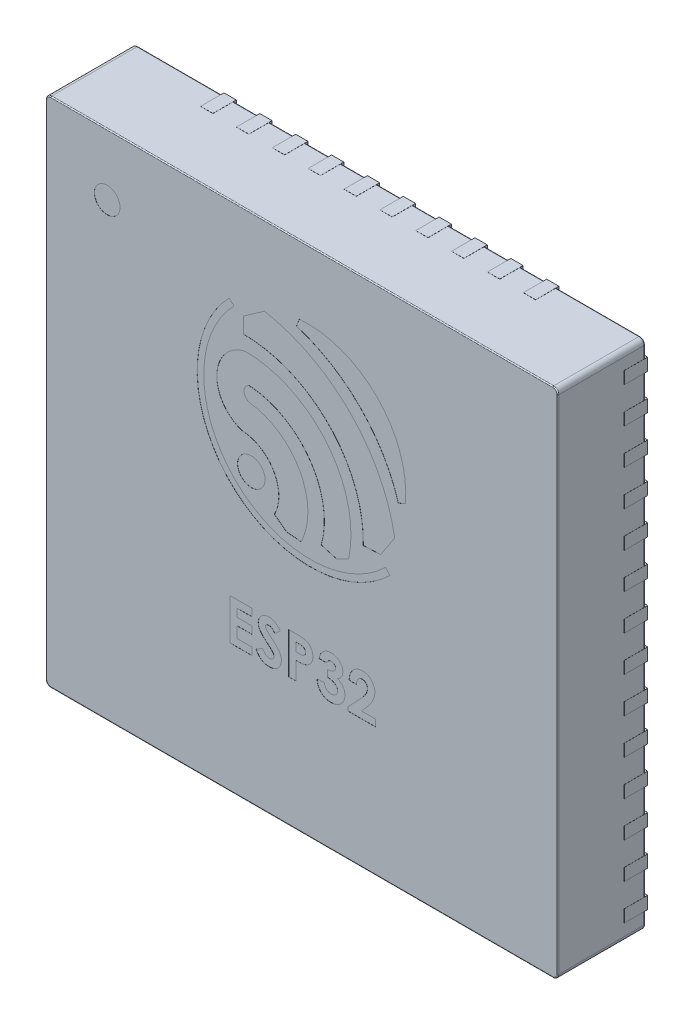
from build123d import *

# Parameters (mm, degrees)
SKETCH1_W                = 5
SKETCH1_H                = 5
BOSS_EXTRUDE1_DEPTH      = 0.85
FILLET1_R                = 0.05
FILLET2_R                = 0.01
BOSS_EXTRUDE2_DEPTH      = 0.025
BOSS_EXTRUDE2_DEPTH_BACK = 0.203
SKETCH2_W                = 0.12
SKETCH2_H                = 0.35
SKETCH2_W_2              = 0.35
SKETCH2_H_2              = 0.12
SKETCH3_R                = 0.125
SKETCH3_R_2              = 0.134340001
CUT_EXTRUDE1_DEPTH       = 0.001
BODY_MOVE_COPY1_ANGLE    = 180


with BuildPart() as part:
    # Sketch1 → Boss-Extrude1 (new body)
    with BuildSketch(Plane(origin=(0, 0, 0), x_dir=(1, 0, 0), z_dir=(0, 1, 0))):
        Rectangle(SKETCH1_W, SKETCH1_H)
    extrude(amount=BOSS_EXTRUDE1_DEPTH)

    # Fillet1
    fillet1_edges = [part.edges().sort_by_distance(p)[0] for p in [
        (2.5, 0.425, 2.5),
        (-2.5, 0.425, 2.5),
        (-2.5, 0.425, -2.5),
        (2.5, 0.425, -2.5),
    ]]
    fillet(fillet1_edges, radius=FILLET1_R)

    # Fillet2
    fillet2_edges = [part.edges().sort_by_distance(p)[0] for p in [
        (0, 0, -2.5),
        (0, 0.85, -2.5),
        (2.5, 0, 0),
        (0, 0, 2.5),
        (-2.5, 0, 0),
        (-2.485355339, 0, -2.485355339),
        (-2.485355339, 0, 2.485355339),
        (2.485355339, 0, 2.485355339),
        (2.485355339, 0, -2.485355339),
        (2.5, 0.85, 0),
        (-2.5, 0.85, 0),
        (0, 0.85, 2.5),
        (-2.485355339, 0.85, -2.485355339),
        (-2.485355339, 0.85, 2.485355339),
        (2.485355339, 0.85, 2.485355339),
        (2.485355339, 0.85, -2.485355339),
    ]]
    fillet(fillet2_edges, radius=FILLET2_R)

    # Sketch2 → Boss-Extrude2 (add, two sides: drawn at the far end of the back side and taken through both)
    with BuildSketch(Plane.XZ.offset(-BOSS_EXTRUDE2_DEPTH_BACK)):
        with BuildLine():
            Line((1.5, 1.85), (1.85, 1.5))
            Line((1.85, 1.5), (1.85, -1.75))
            ThreePointArc((1.85, -1.75), (1.820710678, -1.820710678), (1.75, -1.85))
            Line((1.75, -1.85), (-1.75, -1.85))
            ThreePointArc((-1.75, -1.85), (-1.820710678, -1.820710678), (-1.85, -1.75))
            Line((-1.85, -1.75), (-1.85, 1.75))
            ThreePointArc((-1.85, 1.75), (-1.820710678, 1.820710678), (-1.75, 1.85))
            Line((-1.75, 1.85), (1.5, 1.85))
        make_face()
        with Locations((-0.175, 2.326)):
            Rectangle(SKETCH2_W, SKETCH2_H)
        with Locations((-0.525, 2.326)):
            Rectangle(SKETCH2_W, SKETCH2_H)
        with Locations((-0.875, 2.326)):
            Rectangle(SKETCH2_W, SKETCH2_H)
        with Locations((-1.225, 2.326)):
            Rectangle(SKETCH2_W, SKETCH2_H)
        with Locations((-1.575, 2.326)):
            Rectangle(SKETCH2_W, SKETCH2_H)
        with Locations((1.575, 2.326)):
            Rectangle(SKETCH2_W, SKETCH2_H)
        with Locations((1.225, 2.326)):
            Rectangle(SKETCH2_W, SKETCH2_H)
        with Locations((0.875, 2.326)):
            Rectangle(SKETCH2_W, SKETCH2_H)
        with Locations((0.525, 2.326)):
            Rectangle(SKETCH2_W, SKETCH2_H)
        with Locations((0.175, 2.326)):
            Rectangle(SKETCH2_W, SKETCH2_H)
        with Locations((0.175, -2.326)):
            Rectangle(SKETCH2_W, SKETCH2_H)
        with Locations((0.525, -2.326)):
            Rectangle(SKETCH2_W, SKETCH2_H)
        with Locations((0.875, -2.326)):
            Rectangle(SKETCH2_W, SKETCH2_H)
        with Locations((1.225, -2.326)):
            Rectangle(SKETCH2_W, SKETCH2_H)
        with Locations((1.575, -2.326)):
            Rectangle(SKETCH2_W, SKETCH2_H)
        with Locations((-1.575, -2.326)):
            Rectangle(SKETCH2_W, SKETCH2_H)
        with Locations((-1.225, -2.326)):
            Rectangle(SKETCH2_W, SKETCH2_H)
        with Locations((-0.875, -2.326)):
            Rectangle(SKETCH2_W, SKETCH2_H)
        with Locations((-0.525, -2.326)):
            Rectangle(SKETCH2_W, SKETCH2_H)
        with Locations((-0.175, -2.326)):
            Rectangle(SKETCH2_W, SKETCH2_H)
        with Locations((-2.326, 0.175)):
            Rectangle(SKETCH2_W_2, SKETCH2_H_2)
        with Locations((-2.326, 0.525)):
            Rectangle(SKETCH2_W_2, SKETCH2_H_2)
        with Locations((-2.326, 0.875)):
            Rectangle(SKETCH2_W_2, SKETCH2_H_2)
        with Locations((-2.326, 1.225)):
            Rectangle(SKETCH2_W_2, SKETCH2_H_2)
        with Locations((-2.326, 1.575)):
            Rectangle(SKETCH2_W_2, SKETCH2_H_2)
        with Locations((-2.326, 1.925)):
            Rectangle(SKETCH2_W_2, SKETCH2_H_2)
        with Locations((-2.326, 2.275)):
            Rectangle(SKETCH2_W_2, SKETCH2_H_2)
        with Locations((-2.326, -2.275)):
            Rectangle(SKETCH2_W_2, SKETCH2_H_2)
        with Locations((-2.326, -1.925)):
            Rectangle(SKETCH2_W_2, SKETCH2_H_2)
        with Locations((-2.326, -1.575)):
            Rectangle(SKETCH2_W_2, SKETCH2_H_2)
        with Locations((-2.326, -1.225)):
            Rectangle(SKETCH2_W_2, SKETCH2_H_2)
        with Locations((-2.326, -0.875)):
            Rectangle(SKETCH2_W_2, SKETCH2_H_2)
        with Locations((-2.326, -0.525)):
            Rectangle(SKETCH2_W_2, SKETCH2_H_2)
        with Locations((-2.326, -0.175)):
            Rectangle(SKETCH2_W_2, SKETCH2_H_2)
        with Locations((2.326, -0.175)):
            Rectangle(SKETCH2_W_2, SKETCH2_H_2)
        with Locations((2.326, -0.525)):
            Rectangle(SKETCH2_W_2, SKETCH2_H_2)
        with Locations((2.326, -0.875)):
            Rectangle(SKETCH2_W_2, SKETCH2_H_2)
        with Locations((2.326, -1.225)):
            Rectangle(SKETCH2_W_2, SKETCH2_H_2)
        with Locations((2.326, -1.575)):
            Rectangle(SKETCH2_W_2, SKETCH2_H_2)
        with Locations((2.326, -1.925)):
            Rectangle(SKETCH2_W_2, SKETCH2_H_2)
        with Locations((2.326, -2.275)):
            Rectangle(SKETCH2_W_2, SKETCH2_H_2)
        with Locations((2.326, 2.275)):
            Rectangle(SKETCH2_W_2, SKETCH2_H_2)
        with Locations((2.326, 1.925)):
            Rectangle(SKETCH2_W_2, SKETCH2_H_2)
        with Locations((2.326, 1.575)):
            Rectangle(SKETCH2_W_2, SKETCH2_H_2)
        with Locations((2.326, 1.225)):
            Rectangle(SKETCH2_W_2, SKETCH2_H_2)
        with Locations((2.326, 0.875)):
            Rectangle(SKETCH2_W_2, SKETCH2_H_2)
        with Locations((2.326, 0.525)):
            Rectangle(SKETCH2_W_2, SKETCH2_H_2)
        with Locations((2.326, 0.175)):
            Rectangle(SKETCH2_W_2, SKETCH2_H_2)
    extrude(amount=BOSS_EXTRUDE2_DEPTH + BOSS_EXTRUDE2_DEPTH_BACK)

    # Sketch3 → Cut-Extrude1 (cut)
    # profile 1 of 11: a face of its own
    with BuildSketch(Plane(origin=(0, 0.85, 0), x_dir=(1, 0, 0), z_dir=(0, 1, 0))):
        with Locations(Location((1.9, -1.9, 0), (0, 0, 270))):
            Circle(SKETCH3_R)
    # profile 2 of 11: a face of its own
    with BuildSketch(Plane(origin=(0, 0.85, 0), x_dir=(1, 0, 0), z_dir=(0, 1, 0))):
        with Locations(Location((0.49329124, -0.30672013, 0), (0, 0, 270))):
            Circle(SKETCH3_R_2)
    # profile 3 of 11: a face of its own
    with BuildSketch(Plane(origin=(0, 0.85, 0), x_dir=(1, 0, 0), z_dir=(0, 1, 0))):
        with BuildLine():
            Line((-0.94208876, -0.758808576), (-1.01111876, -0.788208576))
            ThreePointArc((-1.01111876, -0.788208576), (-0.735182235, -1.550293391), (0.02546991, -1.830155047))
            Line((0.02546991, -1.830155047), (0.05178124, -1.756818576))
            ThreePointArc((0.05178124, -1.756818576), (-0.569576166, -1.381719845), (-0.94208876, -0.758808576))
        make_face()
    # profile 4 of 11: a face of its own
    with BuildSketch(Plane(origin=(0, 0.85, 0), x_dir=(1, 0, 0), z_dir=(0, 1, 0))):
        with BuildLine():
            Line((-0.599188761, -0.228917771), (-0.769318761, -0.236207771))
            Line((-0.769318761, -0.236207771), (-0.906808761, -0.446117771))
            ThreePointArc((-0.906808761, -0.446117771), (-0.472732698, -1.287214339), (0.365063195, -1.727627219))
            Line((0.365063195, -1.727627219), (0.571463195, -1.582817219))
            Line((0.571463195, -1.582817219), (0.571463195, -1.430687219))
            ThreePointArc((0.571463195, -1.430687219), (-0.267736701, -1.07710284), (-0.599188761, -0.228917771))
        make_face()
    # profile 5 of 11: a face of its own
    with BuildSketch(Plane(origin=(0, 0.85, 0), x_dir=(1, 0, 0), z_dir=(0, 1, 0))):
        with BuildLine():
            Line((0.66189124, -1.623318576), (0.70998124, -1.665858576))
            ThreePointArc((0.70998124, -1.665858576), (0.695008807, -0.110941509), (-0.859971661, -0.10574522))
            Line((-0.859971661, -0.10574522), (-0.817204672, -0.153640296))
            ThreePointArc((-0.817204672, -0.153640296), (0.649763481, -0.156397963), (0.66189124, -1.623318576))
        make_face()
    # profile 6 of 11: a face of its own
    with BuildSketch(Plane(origin=(0, 0.85, 0), x_dir=(1, 0, 0), z_dir=(0, 1, 0))):
        with BuildLine():
            Line((0.267423643, -0.058844391), (0.149043643, 0.030735609))
            Line((0.149043643, 0.030735609), (0.006903643, 0.043245609))
            ThreePointArc((0.006903643, 0.043245609), (0.019859029, -0.551251626), (0.513813949, -0.88231558))
            ThreePointArc((0.513813949, -0.88231558), (0.564101838, -0.953814834), (0.511159964, -1.02337181))
            ThreePointArc((0.511159964, -1.02337181), (-0.077147368, -0.694109806), (-0.189295274, -0.02932275))
            Line((-0.189295274, -0.02932275), (-0.339535274, 0.01540725))
            Line((-0.339535274, 0.01540725), (-0.456583251, -0.04317667))
            ThreePointArc((-0.456583251, -0.04317667), (-0.250094648, -0.910432452), (0.554224726, -1.29493275))
            ThreePointArc((0.554224726, -1.29493275), (0.83019729, -0.962662211), (0.583713532, -0.607964701))
            ThreePointArc((0.583713532, -0.607964701), (0.274602011, -0.420360357), (0.267423643, -0.058844391))
        make_face()
    # profile 7 of 11: a face of its own
    with BuildSketch(Plane(origin=(0, 0.85, 0), x_dir=(1, 0, 0), z_dir=(0, 1, 0))):
        with BuildLine():
            Line((-0.533333333, 0.978333333), (-0.461538462, 0.978333333))
            add(Edge.make_bspline(
                [(-0.461538462, 0.978333333), (-0.461848411, 0.972902374), (-0.462454033, 0.962290606), (-0.464865688, 0.946877627), (-0.468088919, 0.932310492), (-0.472427468, 0.918632998), (-0.477771364, 0.905839397), (-0.484253611, 0.893972067), (-0.491680672, 0.882945974), (-0.500202254, 0.872954494), (-0.509472506, 0.863971849), (-0.519467662, 0.856118985), (-0.530159331, 0.849545111), (-0.54147602, 0.844152532), (-0.553373277, 0.839837774), (-0.565971309, 0.836954528), (-0.579158952, 0.835001543), (-0.588187043, 0.834830677), (-0.592788462, 0.83474359)],
                knots=[0, 0, 0, 0, 1.198928049, 2.342633425, 3.435730849, 4.486331048, 5.502589352, 6.488331875, 7.46361919, 8.428949135, 9.378681775, 10.305958057, 11.226249248, 12.140413166, 13.066341608, 14.010670971, 14.986082777, 16, 16, 16, 16], degree=3))
            add(Edge.make_bspline(
                [(-0.592788462, 0.83474359), (-0.59843905, 0.834908269), (-0.609475169, 0.835229903), (-0.625460315, 0.838326648), (-0.640484419, 0.843096849), (-0.654399015, 0.84995776), (-0.667131174, 0.858648889), (-0.678529538, 0.869122818), (-0.688646419, 0.881251069), (-0.6971483, 0.894944996), (-0.704063409, 0.909496014), (-0.709056275, 0.924454365), (-0.712299223, 0.939518448), (-0.712647496, 0.949658233), (-0.712820513, 0.954695513)],
                knots=[0, 0, 0, 0, 1.075206757, 2.099977874, 3.089436832, 4.070080219, 5.043757236, 6.01602434, 7.009399377, 8.042659726, 9.078134622, 10.07077983, 11.041594984, 12, 12, 12, 12], degree=3))
            add(Edge.make_bspline(
                [(-0.712820513, 0.954695513), (-0.712753404, 0.957742592), (-0.712618332, 0.963875609), (-0.711679155, 0.97315637), (-0.710270203, 0.98260991), (-0.708145847, 0.992228123), (-0.705496604, 1.002013708), (-0.702282679, 1.01199594), (-0.69842957, 1.022118258), (-0.694001388, 1.032494456), (-0.688719194, 1.043158745), (-0.682566188, 1.054268824), (-0.675372589, 1.065855264), (-0.667208629, 1.077881992), (-0.658131816, 1.090442279), (-0.648003991, 1.103387367), (-0.636954867, 1.116863405), (-0.62911041, 1.125869628), (-0.625080128, 1.130496795)],
                knots=[0, 0, 0, 0, 0.728286467, 1.465860763, 2.227952348, 3.011875114, 3.818782069, 4.650637576, 5.517456182, 6.406927181, 7.346324104, 8.360844784, 9.441645378, 10.605053135, 11.834886952, 13.145197974, 14.533275831, 16, 16, 16, 16], degree=3))
            Line((-0.625080128, 1.130496795), (-0.583333333, 1.178333333))
            Line((-0.583333333, 1.178333333), (-0.717948718, 1.178333333))
            Line((-0.717948718, 1.178333333), (-0.717948718, 1.245))
            Line((-0.717948718, 1.245), (-0.451282051, 1.245))
            Line((-0.451282051, 1.245), (-0.451282051, 1.208621795))
            Line((-0.451282051, 1.208621795), (-0.569711538, 1.082580128))
            add(Edge.make_bspline(
                [(-0.569711538, 1.082580128), (-0.573140431, 1.07890349), (-0.579781178, 1.071782933), (-0.589229396, 1.061325039), (-0.597782345, 1.05140289), (-0.605248782, 1.041901421), (-0.612080449, 1.03314234), (-0.61779564, 1.024794519), (-0.622772872, 1.017093049), (-0.627972116, 1.007705263), (-0.63302332, 0.996593223), (-0.637655193, 0.983799609), (-0.640450338, 0.971563287), (-0.640839126, 0.963575561), (-0.641025641, 0.95974359)],
                knots=[0, 0, 0, 0, 1.246192343, 2.413505005, 3.49357156, 4.492416076, 5.408771964, 6.246246772, 6.999304986, 7.680960093, 8.904522682, 10.020616941, 11.0504258, 12, 12, 12, 12], degree=3))
            add(Edge.make_bspline(
                [(-0.641025641, 0.95974359), (-0.640888728, 0.956035218), (-0.640623438, 0.948849653), (-0.637635446, 0.938657963), (-0.633164672, 0.929360403), (-0.626673956, 0.921380503), (-0.618839827, 0.914765908), (-0.609735267, 0.909918813), (-0.599527444, 0.907069945), (-0.592379212, 0.906719), (-0.588701923, 0.906538462)],
                knots=[0, 0, 0, 0, 1.061596218, 2.057012874, 3.024113775, 4.006148568, 4.986025304, 5.949989669, 6.945406325, 8, 8, 8, 8], degree=3))
            add(Edge.make_bspline(
                [(-0.588701923, 0.906538462), (-0.586802563, 0.906605641), (-0.583063369, 0.906737894), (-0.577567045, 0.90761827), (-0.572336898, 0.90916984), (-0.567314714, 0.911248725), (-0.56255409, 0.914004302), (-0.558067034, 0.91740099), (-0.55380627, 0.921352471), (-0.549791339, 0.925846389), (-0.546137227, 0.930861604), (-0.542891658, 0.93635231), (-0.540208113, 0.942315101), (-0.537845423, 0.948671257), (-0.536023203, 0.955489049), (-0.534696401, 0.962727675), (-0.533687722, 0.970375356), (-0.533453612, 0.975632418), (-0.533333333, 0.978333333)],
                knots=[0, 0, 0, 0, 0.903469896, 1.778625579, 2.63899355, 3.493148037, 4.358286772, 5.247621495, 6.164656832, 7.118446693, 8.109501108, 9.111810964, 10.146451449, 11.215617525, 12.33435995, 13.498009769, 14.714554818, 16, 16, 16, 16], degree=3))
        make_face()
    # profile 8 of 11: a face of its own
    with BuildSketch(Plane(origin=(0, 0.85, 0), x_dir=(1, 0, 0), z_dir=(0, 1, 0))):
        with BuildLine():
            Line((-0.241025641, 0.942435897), (-0.169230769, 0.942435897))
            add(Edge.make_bspline(
                [(-0.169230769, 0.942435897), (-0.169734506, 0.938846343), (-0.170718429, 0.931835054), (-0.173137182, 0.921660172), (-0.175934323, 0.91198461), (-0.179511471, 0.902860293), (-0.183640643, 0.894297058), (-0.188455818, 0.886287242), (-0.193733569, 0.878715897), (-0.197865718, 0.874178624), (-0.199919872, 0.871923077)],
                knots=[0, 0, 0, 0, 1.1115466, 2.171125598, 3.205689823, 4.19946166, 5.17440286, 6.118867946, 7.064860634, 8, 8, 8, 8], degree=3))
            add(Edge.make_bspline(
                [(-0.199919872, 0.871923077), (-0.20287541, 0.868942445), (-0.208700464, 0.863067932), (-0.218434814, 0.85554333), (-0.22863821, 0.849031298), (-0.239515286, 0.843868513), (-0.250896787, 0.839689836), (-0.262873221, 0.836883009), (-0.27539565, 0.835020655), (-0.283940633, 0.834837207), (-0.288301282, 0.83474359)],
                knots=[0, 0, 0, 0, 1.01925491, 2.00884431, 2.983262333, 3.955970413, 4.92937149, 5.924503185, 6.940838805, 8, 8, 8, 8], degree=3))
            add(Edge.make_bspline(
                [(-0.288301282, 0.83474359), (-0.292178124, 0.834835114), (-0.299799213, 0.835015033), (-0.311000297, 0.836459325), (-0.321679593, 0.838992453), (-0.331949985, 0.84230446), (-0.341660428, 0.846810999), (-0.351025241, 0.852042132), (-0.359782772, 0.858458334), (-0.367953511, 0.865707996), (-0.375459892, 0.873549216), (-0.381960452, 0.881930835), (-0.3875491, 0.89062896), (-0.392153406, 0.899715858), (-0.395693492, 0.909206904), (-0.398150417, 0.919047269), (-0.399758534, 0.929215241), (-0.399918744, 0.936126274), (-0.4, 0.93963141)],
                knots=[0, 0, 0, 0, 1.091422571, 2.145516843, 3.172569842, 4.178562979, 5.178154469, 6.181868002, 7.194278174, 8.227918432, 9.254613415, 10.245994977, 11.209837596, 12.161663635, 13.10878368, 14.055455738, 15.013766427, 16, 16, 16, 16], degree=3))
            add(Edge.make_bspline(
                [(-0.4, 0.93963141), (-0.399830048, 0.943971459), (-0.399494441, 0.952541855), (-0.396840278, 0.965060586), (-0.39257356, 0.97700354), (-0.386506919, 0.988229211), (-0.378888544, 0.998725904), (-0.369546051, 1.008127017), (-0.358740151, 1.016578144), (-0.350628243, 1.021119837), (-0.346474359, 1.023445513)],
                knots=[0, 0, 0, 0, 0.992776698, 1.96045919, 2.915875678, 3.886951799, 4.871409521, 5.874469288, 6.911574252, 8, 8, 8, 8], degree=3))
            add(Edge.make_bspline(
                [(-0.346474359, 1.023445513), (-0.349325628, 1.02438149), (-0.354928244, 1.026220644), (-0.362890083, 1.029845073), (-0.370467114, 1.033797557), (-0.377486053, 1.03841166), (-0.384139377, 1.043367566), (-0.390216583, 1.048931741), (-0.395875041, 1.054961359), (-0.400974765, 1.061520567), (-0.405534155, 1.068500307), (-0.409552301, 1.075775128), (-0.412924281, 1.08337162), (-0.415754366, 1.091233959), (-0.417913643, 1.099439522), (-0.419432773, 1.107960503), (-0.420311153, 1.11677637), (-0.420445094, 1.122749155), (-0.420512821, 1.125769231)],
                knots=[0, 0, 0, 0, 1.059375415, 2.081625174, 3.086260357, 4.075579879, 5.045586876, 6.014170127, 6.982201689, 7.963705737, 8.945119069, 9.924852636, 10.896327119, 11.878239286, 12.873838556, 13.889973282, 14.933087432, 16, 16, 16, 16], degree=3))
            add(Edge.make_bspline(
                [(-0.420512821, 1.125769231), (-0.42038728, 1.130209463), (-0.420139633, 1.138968417), (-0.418249278, 1.151827447), (-0.415213051, 1.164153387), (-0.410947233, 1.175961772), (-0.405361939, 1.187217141), (-0.398616047, 1.197995179), (-0.390627141, 1.208211196), (-0.381516347, 1.217774681), (-0.371483209, 1.226551231), (-0.360675049, 1.234297881), (-0.349085081, 1.240685662), (-0.336989763, 1.24614502), (-0.32411762, 1.250196849), (-0.310634891, 1.253164024), (-0.296443196, 1.254969352), (-0.286757468, 1.255159368), (-0.281810897, 1.25525641)],
                knots=[0, 0, 0, 0, 1.005301618, 1.9830924, 2.936709333, 3.876255674, 4.820386332, 5.77704884, 6.75110905, 7.752325838, 8.764085485, 9.766124222, 10.757295257, 11.756573224, 12.766631673, 13.80722022, 14.880131728, 16, 16, 16, 16], degree=3))
            add(Edge.make_bspline(
                [(-0.281810897, 1.25525641), (-0.277131407, 1.255154355), (-0.267981283, 1.254954801), (-0.254597569, 1.253226741), (-0.241876637, 1.250441166), (-0.229790584, 1.246507988), (-0.218390867, 1.241440517), (-0.20761107, 1.235323995), (-0.197568875, 1.227971012), (-0.188218049, 1.219555051), (-0.179637868, 1.210242893), (-0.172159904, 1.199958636), (-0.165652104, 1.188926998), (-0.160071518, 1.177124255), (-0.155711286, 1.164445096), (-0.152243709, 1.151002751), (-0.149829581, 1.136739093), (-0.149093331, 1.126926236), (-0.148717949, 1.121923077)],
                knots=[0, 0, 0, 0, 1.066693477, 2.085777942, 3.071407889, 4.032495163, 4.978645371, 5.911608997, 6.853298848, 7.810770565, 8.776420673, 9.735131334, 10.704462168, 11.693492242, 12.70668109, 13.756973703, 14.856375978, 16, 16, 16, 16], degree=3))
            Line((-0.148717949, 1.121923077), (-0.220512821, 1.121923077))
            add(Edge.make_bspline(
                [(-0.220512821, 1.121923077), (-0.220967866, 1.124438726), (-0.221854186, 1.129338611), (-0.223581336, 1.136433254), (-0.225837973, 1.142979471), (-0.228417978, 1.149025354), (-0.231270477, 1.154632952), (-0.234678719, 1.159652307), (-0.23833311, 1.164280679), (-0.243826493, 1.169600682), (-0.25149102, 1.175179829), (-0.26186834, 1.180120978), (-0.273464786, 1.182931195), (-0.28155541, 1.183280826), (-0.285737179, 1.183461538)],
                knots=[0, 0, 0, 0, 0.928450228, 1.808400301, 2.64896863, 3.43999153, 4.194978884, 4.9294959, 5.640047715, 6.332896648, 7.70085756, 9.063442004, 10.482192841, 12, 12, 12, 12], degree=3))
            add(Edge.make_bspline(
                [(-0.285737179, 1.183461538), (-0.287956515, 1.183423349), (-0.292303698, 1.183348543), (-0.29869011, 1.182524115), (-0.304770056, 1.181156492), (-0.310607047, 1.17932077), (-0.316121466, 1.176900033), (-0.321383813, 1.174021296), (-0.32630045, 1.170521673), (-0.330886866, 1.166575346), (-0.335037612, 1.162229748), (-0.338791733, 1.157690483), (-0.341804782, 1.152772074), (-0.344305859, 1.147669029), (-0.346368947, 1.142382668), (-0.347663324, 1.136792708), (-0.348632401, 1.131011193), (-0.348689148, 1.127055615), (-0.348717949, 1.125048077)],
                knots=[0, 0, 0, 0, 1.110416125, 2.175056767, 3.216269732, 4.226816172, 5.232753079, 6.226173397, 7.223992381, 8.247806573, 9.250094092, 10.229378924, 11.190237183, 12.128982156, 13.072570213, 14.022671385, 14.996464856, 16, 16, 16, 16], degree=3))
            add(Edge.make_bspline(
                [(-0.348717949, 1.125048077), (-0.348644822, 1.122851746), (-0.348500119, 1.118505625), (-0.347226736, 1.112136593), (-0.34532067, 1.105986373), (-0.342579393, 1.100105709), (-0.33899231, 1.094529185), (-0.334630785, 1.089210618), (-0.329455363, 1.084192351), (-0.323639354, 1.079328232), (-0.316948093, 1.075070205), (-0.309651783, 1.071149199), (-0.301570674, 1.068027112), (-0.292898633, 1.065239191), (-0.283472604, 1.063202767), (-0.273350837, 1.061724174), (-0.26254974, 1.060623576), (-0.255104401, 1.060465678), (-0.251282051, 1.060384615)],
                knots=[0, 0, 0, 0, 0.809868251, 1.602574917, 2.388262527, 3.182133002, 3.988875265, 4.829537611, 5.714850619, 6.646378958, 7.622533229, 8.636771727, 9.698525113, 10.814716514, 11.996253919, 13.252421425, 14.589425562, 16, 16, 16, 16], degree=3))
            Line((-0.251282051, 1.060384615), (-0.251282051, 0.993717949))
            add(Edge.make_bspline(
                [(-0.251282051, 0.993717949), (-0.256041581, 0.993313795), (-0.264945718, 0.992557704), (-0.277298146, 0.990770797), (-0.287752578, 0.988434494), (-0.296421396, 0.98544169), (-0.303727264, 0.981929466), (-0.309947033, 0.977762541), (-0.315484176, 0.973148648), (-0.320004857, 0.967849105), (-0.323657985, 0.962254859), (-0.326244668, 0.956381315), (-0.327961738, 0.950359048), (-0.328124486, 0.946239806), (-0.328205128, 0.944198718)],
                knots=[0, 0, 0, 0, 1.700278244, 3.18088388, 4.44026007, 5.507838349, 6.439172496, 7.317391478, 8.167251366, 8.996486918, 9.787781501, 10.536992524, 11.275078289, 12, 12, 12, 12], degree=3))
            add(Edge.make_bspline(
                [(-0.328205128, 0.944198718), (-0.328069207, 0.941592848), (-0.327803917, 0.936506741), (-0.325647777, 0.92924541), (-0.322144656, 0.922665192), (-0.317212355, 0.916992941), (-0.311177572, 0.912309618), (-0.304147329, 0.908896094), (-0.29624082, 0.906854285), (-0.290690849, 0.90664612), (-0.287820513, 0.906538462)],
                knots=[0, 0, 0, 0, 1.008776249, 1.968917671, 2.909425455, 3.878736958, 4.86052431, 5.85160606, 6.888892716, 8, 8, 8, 8], degree=3))
            add(Edge.make_bspline(
                [(-0.287820513, 0.906538462), (-0.285219002, 0.90666622), (-0.280056809, 0.906919731), (-0.272511184, 0.908820291), (-0.265353608, 0.911987306), (-0.258767645, 0.916434693), (-0.25276949, 0.921720953), (-0.247740159, 0.927931041), (-0.243645973, 0.934822059), (-0.241902509, 0.939888002), (-0.241025641, 0.942435897)],
                knots=[0, 0, 0, 0, 0.988439209, 1.961366134, 2.938893463, 3.950078543, 4.971412263, 5.967491143, 6.977757845, 8, 8, 8, 8], degree=3))
        make_face()
    # profile 9 of 11: a face of its own
    with BuildSketch(Plane(origin=(0, 0.85, 0), x_dir=(1, 0, 0), z_dir=(0, 1, 0))):
        with BuildLine():
            Line((0.128205128, 0.845), (0.048076923, 0.845))
            add(Edge.make_bspline(
                [(0.048076923, 0.845), (0.04284145, 0.845023435), (0.032741125, 0.845068646), (0.018175626, 0.845616893), (0.004738239, 0.846599381), (-0.007567943, 0.84781359), (-0.018737884, 0.849515835), (-0.028785488, 0.85146741), (-0.037713114, 0.853844722), (-0.045620552, 0.856667434), (-0.052719411, 0.859992389), (-0.059429328, 0.86354381), (-0.065649314, 0.867753469), (-0.071525397, 0.872317926), (-0.077013127, 0.877332141), (-0.082153169, 0.882776297), (-0.086892595, 0.888729512), (-0.091201692, 0.895150775), (-0.095112855, 0.901909353), (-0.098529339, 0.909020659), (-0.101300746, 0.916495039), (-0.10362557, 0.924284388), (-0.105492903, 0.9323883), (-0.106735856, 0.940856632), (-0.107580133, 0.94963025), (-0.107654629, 0.95560158), (-0.107692308, 0.958621795)],
                knots=[0, 0, 0, 0, 1.698787518, 3.27731721, 4.728409951, 6.070286353, 7.288646904, 8.393455548, 9.389990496, 10.283725379, 11.113616976, 11.931887102, 12.744353494, 13.547053751, 14.344590688, 15.153907614, 15.974148981, 16.810666655, 17.660988447, 18.506082349, 19.367288142, 20.244738011, 21.142497992, 22.06302001, 23.020302899, 24, 24, 24, 24], degree=3))
            add(Edge.make_bspline(
                [(-0.107692308, 0.958621795), (-0.107638027, 0.961963083), (-0.10753136, 0.968529125), (-0.106477774, 0.978152487), (-0.104695691, 0.987333736), (-0.102309982, 0.996112095), (-0.099198157, 1.004468359), (-0.095297998, 1.012347634), (-0.090836751, 1.019848654), (-0.085570071, 1.026834224), (-0.079750372, 1.033339904), (-0.073483888, 1.039436491), (-0.066582588, 1.044873405), (-0.059292801, 1.049933305), (-0.051405947, 1.054319194), (-0.043155697, 1.058380345), (-0.034332803, 1.061826603), (-0.028192989, 1.063634623), (-0.025080128, 1.064551282)],
                knots=[0, 0, 0, 0, 1.101767505, 2.165108537, 3.187936629, 4.183892551, 5.162396277, 6.123736501, 7.080098904, 8.036826416, 9.0040019, 9.957275584, 10.916231297, 11.898534744, 12.880877694, 13.889532316, 14.930001539, 16, 16, 16, 16], degree=3))
            add(Edge.make_bspline(
                [(-0.025080128, 1.064551282), (-0.023029589, 1.06506146), (-0.01858746, 1.066166668), (-0.011236956, 1.067288733), (-0.002766273, 1.068320402), (0.006851981, 1.069206997), (0.017623352, 1.069809675), (0.02953741, 1.070280339), (0.042599554, 1.070622561), (0.051682453, 1.070634705), (0.056410256, 1.070641026)],
                knots=[0, 0, 0, 0, 0.618981996, 1.340914327, 2.176866532, 3.120127938, 4.170906482, 5.338178032, 6.614476169, 8, 8, 8, 8], degree=3))
            Line((0.056410256, 1.070641026), (0.056410256, 1.245))
            Line((0.056410256, 1.245), (0.128205128, 1.245))
            Line((0.128205128, 1.245), (0.128205128, 0.845))
        make_face()
        with BuildLine():
            Line((0.056410256, 0.998846154), (0.031009615, 0.998846154))
            add(Edge.make_bspline(
                [(0.031009615, 0.998846154), (0.026387492, 0.998816956), (0.017882717, 0.99876323), (0.006269246, 0.997982188), (-0.003066623, 0.996794697), (-0.010434034, 0.995077659), (-0.016253547, 0.992520984), (-0.021212375, 0.989437369), (-0.025617983, 0.985731846), (-0.029290404, 0.981289502), (-0.032283073, 0.97633326), (-0.034382095, 0.970825696), (-0.035706908, 0.964854826), (-0.03583273, 0.960685695), (-0.035897436, 0.958541667)],
                knots=[0, 0, 0, 0, 1.862351722, 3.426754836, 4.68713255, 5.653025869, 6.462861518, 7.236406327, 7.999926698, 8.771672214, 9.54880311, 10.322347919, 11.137246204, 12, 12, 12, 12], degree=3))
            add(Edge.make_bspline(
                [(-0.035897436, 0.958541667), (-0.035834748, 0.956667989), (-0.035713118, 0.953032603), (-0.034807278, 0.947789529), (-0.033401369, 0.942911489), (-0.031252709, 0.938466481), (-0.02864404, 0.93435083), (-0.025334619, 0.930692655), (-0.021518176, 0.927373604), (-0.018566764, 0.92561899), (-0.017067308, 0.924727564)],
                knots=[0, 0, 0, 0, 1.102449765, 2.139017612, 3.12397484, 4.080535277, 5.035673127, 5.982361139, 6.974944601, 8, 8, 8, 8], degree=3))
            add(Edge.make_bspline(
                [(-0.017067308, 0.924727564), (-0.015797503, 0.924085387), (-0.013109065, 0.922725767), (-0.008530396, 0.92114511), (-0.003246681, 0.919811651), (0.002777749, 0.918704893), (0.009518863, 0.917845934), (0.016975457, 0.917189046), (0.025158505, 0.916924885), (0.030849325, 0.916839405), (0.033814103, 0.916794872)],
                knots=[0, 0, 0, 0, 0.656809284, 1.390599849, 2.23162475, 3.173112763, 4.218524733, 5.370385145, 6.63003504, 8, 8, 8, 8], degree=3))
            Line((0.033814103, 0.916794872), (0.056410256, 0.916794872))
            Line((0.056410256, 0.916794872), (0.056410256, 0.998846154))
        make_face(mode=Mode.SUBTRACT)
    # profile 10 of 11: a face of its own
    with BuildSketch(Plane(origin=(0, 0.85, 0), x_dir=(1, 0, 0), z_dir=(0, 1, 0))):
        with BuildLine():
            Line((0.21025641, 0.898445513), (0.263942308, 0.947564103))
            add(Edge.make_bspline(
                [(0.263942308, 0.947564103), (0.266241539, 0.944319594), (0.270655742, 0.938090591), (0.277817897, 0.929758914), (0.284937263, 0.922604746), (0.292159403, 0.916832635), (0.299359975, 0.912185903), (0.306691957, 0.908980865), (0.314071002, 0.906919686), (0.319031185, 0.906664269), (0.321474359, 0.906538462)],
                knots=[0, 0, 0, 0, 1.299459705, 2.494781419, 3.587730629, 4.594196874, 5.512431013, 6.380462003, 7.202284646, 8, 8, 8, 8], degree=3))
            add(Edge.make_bspline(
                [(0.321474359, 0.906538462), (0.323754215, 0.906616), (0.328156019, 0.906765708), (0.334401888, 0.908328668), (0.340014857, 0.910854328), (0.34484541, 0.914343124), (0.348731486, 0.918509759), (0.351753141, 0.922945345), (0.353509031, 0.927781595), (0.353734522, 0.931098379), (0.353846154, 0.932740385)],
                knots=[0, 0, 0, 0, 1.184157716, 2.286297433, 3.324836695, 4.370048774, 5.362957217, 6.276446515, 7.146738784, 8, 8, 8, 8], degree=3))
            add(Edge.make_bspline(
                [(0.353846154, 0.932740385), (0.353775491, 0.934405297), (0.353633187, 0.937758201), (0.352258719, 0.942672298), (0.350187003, 0.947473943), (0.348207395, 0.950396932), (0.347195513, 0.951891026)],
                knots=[0, 0, 0, 0, 0.967525499, 1.948461899, 2.951351359, 4, 4, 4, 4], degree=3))
            add(Edge.make_bspline(
                [(0.347195513, 0.951891026), (0.346271893, 0.953048914), (0.344133558, 0.95572962), (0.340180106, 0.960043247), (0.335010729, 0.965107205), (0.328843917, 0.971176653), (0.32144824, 0.978015832), (0.312982486, 0.985822762), (0.303258304, 0.994332249), (0.296445521, 1.000339558), (0.29286859, 1.00349359)],
                knots=[0, 0, 0, 0, 0.473849886, 1.097042329, 1.870584189, 2.789244661, 3.865562256, 5.093556389, 6.47402294, 8, 8, 8, 8], degree=3))
            add(Edge.make_bspline(
                [(0.29286859, 1.00349359), (0.28950308, 1.00640478), (0.283116041, 1.011929614), (0.274040071, 1.019784124), (0.266011872, 1.02681892), (0.259104458, 1.03308668), (0.253111419, 1.03832929), (0.248297813, 1.042869282), (0.244457627, 1.046508052), (0.242276852, 1.048708389), (0.241346154, 1.049647436)],
                knots=[0, 0, 0, 0, 1.543627419, 2.929484142, 4.163674036, 5.24627963, 6.164986907, 6.925413438, 7.541394495, 8, 8, 8, 8], degree=3))
            add(Edge.make_bspline(
                [(0.241346154, 1.049647436), (0.237813102, 1.053467953), (0.231021337, 1.060812328), (0.222211739, 1.072224611), (0.214883005, 1.0832792), (0.20920765, 1.094288257), (0.205091633, 1.105479296), (0.202095318, 1.117011985), (0.200299316, 1.129051219), (0.200100539, 1.137248245), (0.2, 1.141394231)],
                knots=[0, 0, 0, 0, 1.206413378, 2.319150186, 3.339784753, 4.27899982, 5.184598145, 6.099639703, 7.038813909, 8, 8, 8, 8], degree=3))
            add(Edge.make_bspline(
                [(0.2, 1.141394231), (0.200071649, 1.145434019), (0.200212228, 1.153360233), (0.201932184, 1.164959606), (0.204388247, 1.176058649), (0.208172749, 1.186546175), (0.212824201, 1.196546467), (0.218493199, 1.20606289), (0.225424115, 1.214873272), (0.233122343, 1.223215342), (0.24177049, 1.23070322), (0.251070033, 1.23730475), (0.261038681, 1.242878587), (0.271600467, 1.247472004), (0.282887852, 1.250880826), (0.294722523, 1.253458094), (0.307223718, 1.255012065), (0.315754126, 1.255173788), (0.320112179, 1.25525641)],
                knots=[0, 0, 0, 0, 1.043039441, 2.046482205, 3.024244422, 3.976033659, 4.920890471, 5.871402525, 6.830893638, 7.812473116, 8.800703348, 9.781190227, 10.754606487, 11.746997808, 12.751247331, 13.796362838, 14.874195872, 16, 16, 16, 16], degree=3))
            add(Edge.make_bspline(
                [(0.320112179, 1.25525641), (0.323533265, 1.255195784), (0.330308975, 1.25507571), (0.340294877, 1.254093387), (0.3499392, 1.25251302), (0.359222683, 1.250230432), (0.36820405, 1.247404204), (0.376785832, 1.243729096), (0.38508213, 1.239573036), (0.393065354, 1.234756835), (0.400669351, 1.229163285), (0.408113206, 1.22301316), (0.415133027, 1.215969152), (0.421997022, 1.208288052), (0.428418517, 1.199747245), (0.434735891, 1.190603731), (0.44064081, 1.180638928), (0.444289948, 1.173649945), (0.446153846, 1.170080128)],
                knots=[0, 0, 0, 0, 1.017088714, 2.014418954, 2.980620591, 3.920647918, 4.854987948, 5.776890852, 6.693269322, 7.612671471, 8.545186947, 9.498010697, 10.480815007, 11.499174288, 12.558697099, 13.655746277, 14.802607237, 16, 16, 16, 16], degree=3))
            Line((0.446153846, 1.170080128), (0.383012821, 1.132179487))
            add(Edge.make_bspline(
                [(0.383012821, 1.132179487), (0.380681528, 1.136231832), (0.376212241, 1.144000522), (0.368638616, 1.154438743), (0.360879823, 1.163377351), (0.352756488, 1.170658356), (0.344367385, 1.176379114), (0.335671995, 1.180467565), (0.326664207, 1.182998312), (0.320528511, 1.183307374), (0.317467949, 1.183461538)],
                knots=[0, 0, 0, 0, 1.283663364, 2.460892379, 3.537111102, 4.529833553, 5.449777664, 6.316464042, 7.160231139, 8, 8, 8, 8], degree=3))
            add(Edge.make_bspline(
                [(0.317467949, 1.183461538), (0.314354346, 1.183336836), (0.308313502, 1.183094895), (0.299676776, 1.180816054), (0.291723595, 1.177318334), (0.284885879, 1.172231439), (0.279079344, 1.166430899), (0.274916655, 1.159888802), (0.272216464, 1.152895383), (0.271935953, 1.1480153), (0.271794872, 1.145560897)],
                knots=[0, 0, 0, 0, 1.13537643, 2.202795631, 3.242191317, 4.290390765, 5.297919085, 6.223733717, 7.106639842, 8, 8, 8, 8], degree=3))
            add(Edge.make_bspline(
                [(0.271794872, 1.145560897), (0.271926928, 1.143278622), (0.272195186, 1.138642397), (0.274160345, 1.131745074), (0.277258266, 1.124881197), (0.280813494, 1.119191673), (0.284520011, 1.114449219), (0.288153108, 1.110401883), (0.292458956, 1.105836728), (0.297547271, 1.100878242), (0.303319086, 1.095431087), (0.309793296, 1.089508215), (0.317039623, 1.083157907), (0.322161546, 1.078832316), (0.324839744, 1.076570513)],
                knots=[0, 0, 0, 0, 0.916057066, 1.860882232, 2.859899639, 3.934694552, 4.546382938, 5.276161949, 6.118633209, 7.067046139, 8.129668089, 9.306861125, 10.591787583, 12, 12, 12, 12], degree=3))
            add(Edge.make_bspline(
                [(0.324839744, 1.076570513), (0.329930912, 1.072262613), (0.339702406, 1.06399445), (0.353513232, 1.05178505), (0.365949359, 1.04036575), (0.376927847, 1.029645194), (0.386481308, 1.019691879), (0.394714912, 1.010593185), (0.401495609, 1.002170689), (0.408526775, 0.992111015), (0.41539643, 0.980025507), (0.421234659, 0.965416936), (0.42500781, 0.950826656), (0.425432162, 0.941015082), (0.425641026, 0.936185897)],
                knots=[0, 0, 0, 0, 1.345685333, 2.582777463, 3.719355561, 4.752181389, 5.678433858, 6.502864483, 7.227563063, 7.858499643, 8.978226409, 10.023061349, 11.026965269, 12, 12, 12, 12], degree=3))
            add(Edge.make_bspline(
                [(0.425641026, 0.936185897), (0.425554119, 0.932761379), (0.425382904, 0.926014711), (0.423860157, 0.916093555), (0.421573771, 0.906524997), (0.418288093, 0.89731146), (0.413881099, 0.888556737), (0.408675631, 0.880119132), (0.402523466, 0.872024434), (0.395472432, 0.864452207), (0.387732336, 0.857491427), (0.379476772, 0.851384444), (0.370782014, 0.846220399), (0.361621694, 0.842013472), (0.352012022, 0.8387306), (0.341944122, 0.836410542), (0.331448848, 0.835027), (0.324309751, 0.834839237), (0.320673077, 0.83474359)],
                knots=[0, 0, 0, 0, 1.010806554, 1.991397492, 2.957573065, 3.913225829, 4.872777376, 5.846906201, 6.837692339, 7.870332167, 8.898170327, 9.907899016, 10.8981826, 11.879407896, 12.8797257, 13.891947133, 14.926152479, 16, 16, 16, 16], degree=3))
            add(Edge.make_bspline(
                [(0.320673077, 0.83474359), (0.315960406, 0.834916459), (0.306572266, 0.835260832), (0.292687521, 0.837939675), (0.279118805, 0.842196883), (0.268151019, 0.847211683), (0.259499236, 0.852224393), (0.252852333, 0.856745827), (0.246036005, 0.861937985), (0.239175388, 0.867951963), (0.232010326, 0.874440114), (0.224902732, 0.881847697), (0.217504554, 0.88979517), (0.212714784, 0.895511552), (0.21025641, 0.898445513)],
                knots=[0, 0, 0, 0, 1.282890948, 2.555655204, 3.837225328, 5.149160694, 5.83044799, 6.558852598, 7.337307105, 8.162686284, 9.043076448, 9.969084596, 10.957622644, 12, 12, 12, 12], degree=3))
        make_face()
    # profile 11 of 11: a face of its own
    with BuildSketch(Plane(origin=(0, 0.85, 0), x_dir=(1, 0, 0), z_dir=(0, 1, 0))):
        Polygon((0.702564103, 0.845), (0.487179487, 0.845), (0.487179487, 0.916794872), (0.630769231, 0.916794872), (0.630769231, 0.993717949), (0.487179487, 0.993717949), (0.487179487, 1.065512821), (0.630769231, 1.065512821), (0.630769231, 1.173205128), (0.487179487, 1.173205128), (0.487179487, 1.245), (0.702564103, 1.245), align=None)
    extrude(amount=-CUT_EXTRUDE1_DEPTH, mode=Mode.SUBTRACT)


with BuildPart() as part_1:
    # Body-Move/Copy1: moved
    add(part.part.rotate(Axis((0, 0, 0), (-4.937700262164522e-15, 0.7071067811865462, 0.7071067811865488)), BODY_MOVE_COPY1_ANGLE))


with BuildPart() as part_2:
    # Body-Move/Copy2: moved
    add(part_1.part.moved(Location((0, 0, 0.025))))


solid = part_2.part
